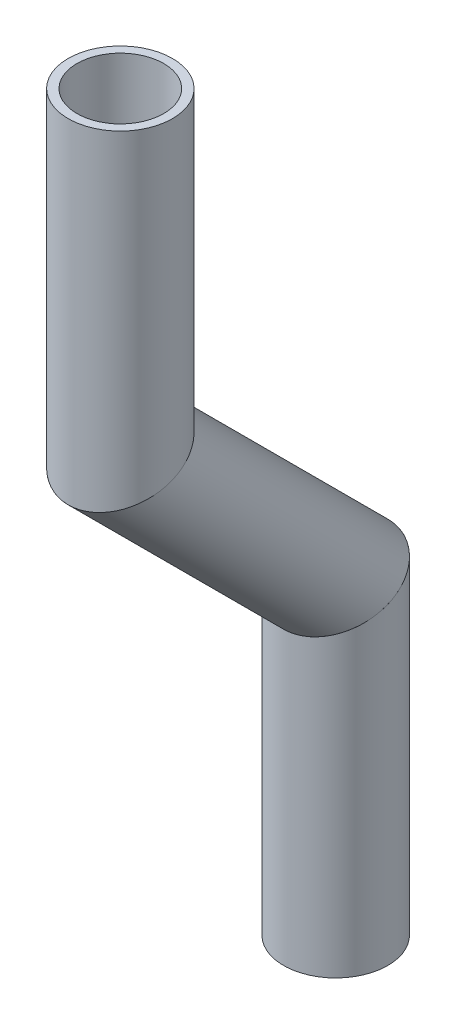
from build123d import *

# Parameters (mm, degrees)
SKETCH11_R                = 6.35
SKETCH11_R_2              = 5.2832
PIPE_0_5_SCH_40_1_DEPTH   = 42.819743879
SKETCH11_ON_SEGMENT_2_R   = 6.35
SKETCH11_ON_SEGMENT_2_R_2 = 5.2832
PIPE_0_5_SCH_40_1_2_DEPTH = 46.529436071
SKETCH11_ON_SEGMENT_3_R   = 6.35
SKETCH11_ON_SEGMENT_3_R_2 = 5.2832
PIPE_0_5_SCH_40_1_3_DEPTH = 42.819743879


with BuildPart() as part:
    # Sketch11 → Pipe 0.5 SCH 40(1) (new body)
    with BuildSketch(Plane(origin=(0, -210.601594492, 300.531279363), x_dir=(0, 0, -1), z_dir=(0, -1, 0))):
        Circle(SKETCH11_R)
        Circle(SKETCH11_R_2, mode=Mode.SUBTRACT)
    extrude(amount=PIPE_0_5_SCH_40_1_DEPTH)

    # Pipe 0.5 SCH 40(1) mitre 1
    split(bisect_by=Plane(origin=(0, -248.701594492, 300.531279363), x_dir=(-1, 0, 0), z_dir=(0, 0.923879533, 0.382683432)), keep=Keep.TOP)


with BuildPart() as body_2:
    # Sketch11 on segment 2 (carried to segment 2) → Pipe 0.5 SCH 40_1 2 (new body)
    with BuildSketch(Plane(origin=(0, -245.36423159, 303.868642265), x_dir=(0, 0.707106781, -0.707106781), z_dir=(0, -0.707106781, -0.707106781))):
        Circle(SKETCH11_ON_SEGMENT_2_R)
        Circle(SKETCH11_ON_SEGMENT_2_R_2, mode=Mode.SUBTRACT)
    extrude(amount=PIPE_0_5_SCH_40_1_2_DEPTH)

    # Pipe 0.5 SCH 40_1 2 mitre 1
    split(bisect_by=Plane(origin=(0, -248.701594492, 300.531279363), x_dir=(1, 0, 0), z_dir=(0, -0.923879533, -0.382683432)), keep=Keep.TOP)

    # Pipe 0.5 SCH 40_1 2 mitre 2
    split(bisect_by=Plane(origin=(0, -274.928148458, 274.304725397), x_dir=(-1, 0, 0), z_dir=(0, 0.923879533, 0.382683432)), keep=Keep.TOP)


with BuildPart() as body_3:
    # Sketch11 on segment 3 (carried to segment 3) → Pipe 0.5 SCH 40_1 3 (new body)
    with BuildSketch(Plane(origin=(0, -270.208404579, 274.304725397), x_dir=(0, 0, -1), z_dir=(0, -1, 0))):
        Circle(SKETCH11_ON_SEGMENT_3_R)
        Circle(SKETCH11_ON_SEGMENT_3_R_2, mode=Mode.SUBTRACT)
    extrude(amount=PIPE_0_5_SCH_40_1_3_DEPTH)

    # Pipe 0.5 SCH 40_1 3 mitre 1
    split(bisect_by=Plane(origin=(0, -274.928148458, 274.304725397), x_dir=(1, 0, 0), z_dir=(0, -0.923879533, -0.382683432)), keep=Keep.TOP)


solid = Compound([part.part, body_2.part, body_3.part])
